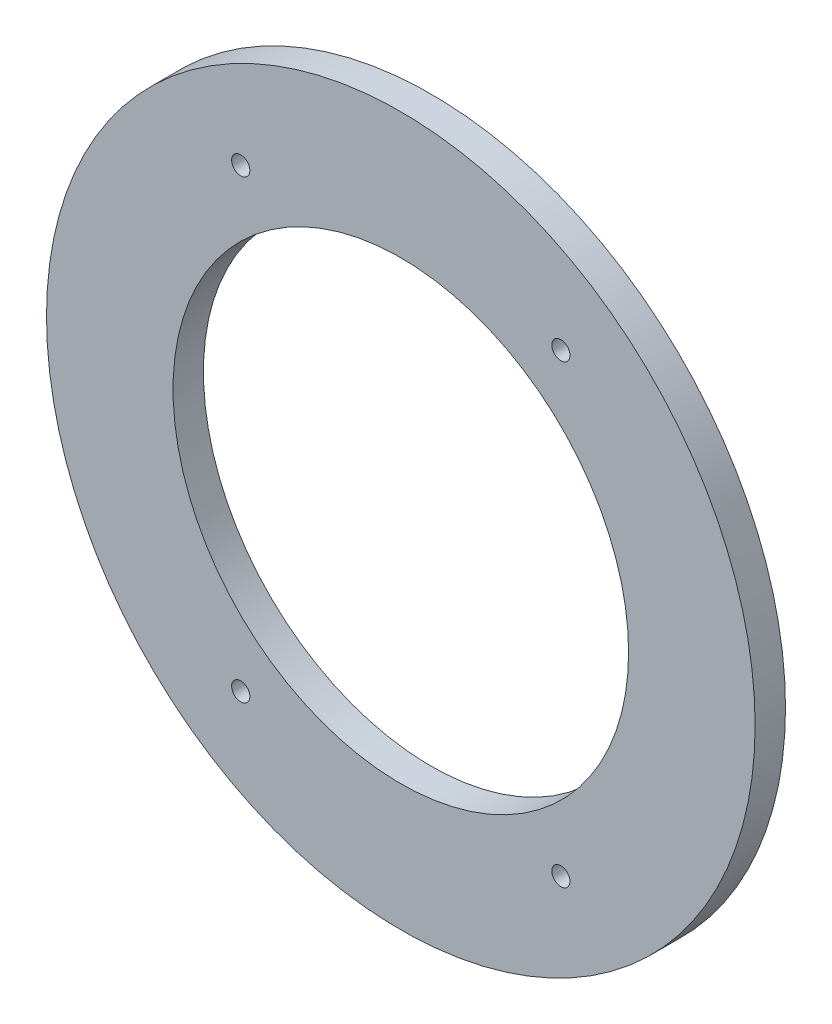
from build123d import *

# Parameters (mm, degrees)
ACRYLIC_BOARD_SKETCH_R    = 70
ACRYLIC_BOARD_SKETCH_R_2  = 45
ACRYLIC_BOARD_SKETCH_R_3  = 1.8
ACRYLIC_BOARD_DEPTH       = 6
WIRING_DITCH_1_DEPTH      = 0.5
DEVICE_DITCH_1_SKETCH_R   = 0.7
DEVICE_DITCH_1_SKETCH_R_2 = 1.8
DEVICE_DITCH_1_SKETCH_R_3 = 1.4
DEVICE_DITCH_1_DEPTH      = 3.5
DEVICE_DITCH_2_SKETCH_W   = 4
DEVICE_DITCH_2_SKETCH_H   = 1.483
DEVICE_DITCH_2_SKETCH_W_2 = 2.208
DEVICE_DITCH_2_SKETCH_H_2 = 1.204
DEVICE_DITCH_2_SKETCH_H_3 = 1.8
DEVICE_DITCH_2_SKETCH_H_4 = 2.966
DEVICE_DITCH_2_DEPTH      = 1.5
WIRING_DITCH_2_SKETCH_W   = 1.621419329
WIRING_DITCH_2_SKETCH_H   = 1.413
WIRING_DITCH_2_SKETCH_W_2 = 0.423202011
WIRING_DITCH_2_SKETCH_H_2 = 2.966
WIRING_DITCH_2_SKETCH_W_3 = 0.680017318
WIRING_DITCH_2_DEPTH      = 0.5


with BuildPart() as part:
    # acrylic board sketch → acrylic board (new body)
    with BuildSketch(Plane.XY):
        Circle(ACRYLIC_BOARD_SKETCH_R)
        Circle(ACRYLIC_BOARD_SKETCH_R_2, mode=Mode.SUBTRACT)
        with Locations((-31.623, 45)):
            Circle(ACRYLIC_BOARD_SKETCH_R_3, mode=Mode.SUBTRACT)
        with Locations((31.625, 45)):
            Circle(ACRYLIC_BOARD_SKETCH_R_3, mode=Mode.SUBTRACT)
        with Locations((31.623, -45)):
            Circle(ACRYLIC_BOARD_SKETCH_R_3, mode=Mode.SUBTRACT)
        with Locations((-31.623, -45)):
            Circle(ACRYLIC_BOARD_SKETCH_R_3, mode=Mode.SUBTRACT)
    extrude(amount=ACRYLIC_BOARD_DEPTH)

    # wiring ditch 1 sketch → wiring ditch 1 (cut)
    # profile 1 of 4: a face of its own
    with BuildSketch(Plane(origin=(0, 0, 0), x_dir=(-1, 0, 0), z_dir=(0, 0, -1))):
        Polygon((28.086824216, 58.298311689), (8.1117e-05, 64.716064274), (-28.073683973, 58.304614159), (-50.593630324, 40.351043203), (-63.058768743, 14.457487783), (-64.688870912, 0), (-63.058781159, -14.457377666), (-50.593630241, -40.361156881), (-28.073484596, -58.304659693), (0, -64.716045749), (28.073683973, -58.304614159), (50.593541654, -40.351113893), (63.094217318, -14.393964639), (63.094217318, 5.899242758), (63.094217318, 14.383851246), (50.593666945, 40.350967131), align=None)
        Polygon((0, 63.28), (-27.450658291, 57.010854209), (-49.470883109, 39.45567612), (-61.694217318, 14.064415221), (-63.28, 0), (-61.694217318, -14.064415221), (-49.470883109, -39.46567612), (-27.450658291, -57.010854209), (0, -63.28), (27.450658291, -57.010854209), (49.470883109, -39.45567612), (61.694217318, -14.074415221), (61.694217318, 5.899242758), (61.694217318, 14.064415221), (49.470883109, 39.45567612), (27.463651187, 57.004622403), align=None, mode=Mode.SUBTRACT)
    # profile 2 of 4: a face of its own
    with BuildSketch(Plane(origin=(0, 0, 0), x_dir=(-1, 0, 0), z_dir=(0, 0, -1))):
        Polygon((27.463651187, 57.004622403), (0, 63.28), (-27.450658291, 57.010854209), (-49.470883109, 39.45567612), (-61.694217318, 14.064415221), (-63.28, 0), (-61.694217318, -14.064415221), (-49.470883109, -39.46567612), (-27.450658291, -57.010854209), (0, -63.28), (27.450658291, -57.010854209), (49.470883109, -39.45567612), (61.694217318, -14.074415221), (61.694217318, 5.899242758), (61.694217318, 14.064415221), (49.470883109, 39.45567612), align=None)
        Polygon((-8.1117e-05, 61.843935726), (-26.827632609, 55.717094259), (-48.348135894, 38.560309037), (-60.329665893, 13.671342658), (-61.871129088, 0), (-60.329653477, -13.671452775), (-48.348135977, -38.570195359), (-26.827831986, -55.717048725), (0, -61.843954251), (26.827632609, -55.717094259), (48.348224564, -38.560238346), (60.294217318, -13.754865803), (60.294217318, 5.899242758), (60.294217318, 13.744979196), (48.348099273, 38.560385109), (26.840478159, 55.710933118), align=None, mode=Mode.SUBTRACT)
    # profile 3 of 4: a face of its own
    with BuildSketch(Plane(origin=(0, 0, 0), x_dir=(-1, 0, 0), z_dir=(0, 0, -1))):
        Polygon((-54.984505869, 12.623124619), (-44.022978515, 35.392345698), (-31.915926571, 40.144473297), (-24.709927404, 50.79185144), (-9.56e-07, 56.436057963), (24.79568596, 50.772296894), (30.95671437, 39.182859292), (43.988654142, 35.463644088), (55.019982682, 12.549432389), (55.019982682, 0), (55.019982682, -12.559562916), (43.98851079, -35.463685), (30.956715129, -39.182859075), (24.795696967, -50.772304086), (-1.196e-06, -56.436014954), (-24.790136434, -50.773531305), (-31.051894726, -39.183420211), (-43.989281808, -35.472596537), (-54.98452017, -12.622997879), (-56.408884631, 0), align=None)
        Polygon((-53.619982682, 12.229984779), (-42.999916891, 34.28992388), (-31, 39), (-23.859941709, 49.549945791), (0, 55), (23.859948813, 49.549977597), (30, 38), (42.999916891, 34.28992388), (53.619982682, 12.229984779), (53.619982682, 0), (53.619982682, -12.239984779), (42.999916891, -34.28992388), (30, -38), (23.859959836, -49.549983457), (0, -54.9999576), (-23.859941709, -49.549945791), (-30.1, -38), (-42.999916891, -34.29992388), (-53.619982682, -12.229984779), (-55, 0), align=None, mode=Mode.SUBTRACT)
    # profile 4 of 4: a face of its own
    with BuildSketch(Plane(origin=(0, 0, 0), x_dir=(-1, 0, 0), z_dir=(0, 0, -1))):
        Polygon((-42.999916891, 34.28992388), (-31, 39), (-23.859941709, 49.549945791), (0, 55), (23.859948813, 49.549977597), (30, 38), (42.999916891, 34.28992388), (53.619982682, 12.229984779), (53.619982682, 0), (53.619982682, -12.239984779), (42.999916891, -34.28992388), (30, -38), (23.859959836, -49.549983457), (0, -54.9999576), (-23.859941709, -49.549945791), (-30.1, -38), (-42.999916891, -34.29992388), (-53.619982682, -12.229984779), (-55, 0), (-53.619982682, 12.229984779), align=None)
        Polygon((-53.591115369, 0), (-52.255459495, 11.836844939), (-41.976855266, 33.187502062), (-30.084073429, 37.855526703), (-23.009956013, 48.308040142), (9.56e-07, 53.563942037), (22.924211666, 48.327658299), (29.04328563, 36.817140708), (42.01117964, 33.116203672), (52.219982682, 11.910537169), (52.219982682, 0), (52.219982682, -11.920406643), (42.011322992, -33.11616276), (29.043284871, -36.817140925), (22.924222705, -48.327662828), (1.196e-06, -53.563900245), (-22.929746983, -48.326360277), (-29.148105274, -36.816579789), (-42.010551973, -33.127251223), (-52.255445194, -11.836971679), align=None, mode=Mode.SUBTRACT)
    extrude(amount=-WIRING_DITCH_1_DEPTH, mode=Mode.SUBTRACT)

    # device ditch 1 sketch → device ditch 1 (cut)
    with BuildSketch(Plane(origin=(0, 0, 0), x_dir=(-1, 0, 0), z_dir=(0, 0, -1))):
        with Locations((57.6571, 13.1472)):
            Circle(DEVICE_DITCH_1_SKETCH_R)
        with Locations((46.2354, 36.8728)):
            Circle(DEVICE_DITCH_1_SKETCH_R)
        with Locations((25.6618, 53.2773)):
            Circle(DEVICE_DITCH_1_SKETCH_R)
        with Locations((0, 59.14)):
            Circle(DEVICE_DITCH_1_SKETCH_R)
        with Locations((-25.6553, 53.2804)):
            Circle(DEVICE_DITCH_1_SKETCH_R)
        with Locations((-46.2354, 36.8728)):
            Circle(DEVICE_DITCH_1_SKETCH_R)
        with Locations((-57.6571, 13.1472)):
            Circle(DEVICE_DITCH_1_SKETCH_R)
        with Locations((-59.14, 0)):
            Circle(DEVICE_DITCH_1_SKETCH_R)
        with Locations((-57.6571, -13.1472)):
            Circle(DEVICE_DITCH_1_SKETCH_R)
        with Locations((-46.2354, -36.8828)):
            Circle(DEVICE_DITCH_1_SKETCH_R)
        with Locations((-25.6553, -53.2804)):
            Circle(DEVICE_DITCH_1_SKETCH_R)
        with Locations((0, -59.14)):
            Circle(DEVICE_DITCH_1_SKETCH_R)
        with Locations((25.6553, -53.2804)):
            Circle(DEVICE_DITCH_1_SKETCH_R)
        with Locations((46.2354, -36.8728)):
            Circle(DEVICE_DITCH_1_SKETCH_R)
        with Locations((57.6571, -13.1572)):
            Circle(DEVICE_DITCH_1_SKETCH_R)
        with Locations((0, 50.56)):
            Circle(DEVICE_DITCH_1_SKETCH_R_2)
        with Locations((21.93716185, 45.552985961)):
            Circle(DEVICE_DITCH_1_SKETCH_R_2)
        with Locations((39.529399754, 31.523644382)):
            Circle(DEVICE_DITCH_1_SKETCH_R_2)
        with Locations((49.29235524, 11.250658421)):
            Circle(DEVICE_DITCH_1_SKETCH_R_2)
        with Locations((49.29235524, -11.250658421)):
            Circle(DEVICE_DITCH_1_SKETCH_R_2)
        with Locations((39.529399754, -31.523644382)):
            Circle(DEVICE_DITCH_1_SKETCH_R_2)
        with Locations((21.93716185, -45.552985961)):
            Circle(DEVICE_DITCH_1_SKETCH_R_2)
        with Locations((0, -50.56)):
            Circle(DEVICE_DITCH_1_SKETCH_R_2)
        with Locations((-21.93716185, -45.552985961)):
            Circle(DEVICE_DITCH_1_SKETCH_R_2)
        with Locations((-39.529399754, -31.523644382)):
            Circle(DEVICE_DITCH_1_SKETCH_R_2)
        with Locations((-49.29235524, -11.250658421)):
            Circle(DEVICE_DITCH_1_SKETCH_R_2)
        with Locations((-49.29235524, 11.250658421)):
            Circle(DEVICE_DITCH_1_SKETCH_R_2)
        with Locations((-39.529399754, 31.523644382)):
            Circle(DEVICE_DITCH_1_SKETCH_R_2)
        with Locations((-21.93716185, 45.552985961)):
            Circle(DEVICE_DITCH_1_SKETCH_R_2)
        with Locations((-50.56, 0)):
            Circle(DEVICE_DITCH_1_SKETCH_R_2)
        with Locations((0, 63.28)):
            Circle(DEVICE_DITCH_1_SKETCH_R_3)
        with Locations((0, 55)):
            Circle(DEVICE_DITCH_1_SKETCH_R_3)
        with Locations((23.863605651, 49.553287735)):
            Circle(DEVICE_DITCH_1_SKETCH_R_3)
        with Locations((27.456163011, 57.013309961)):
            Circle(DEVICE_DITCH_1_SKETCH_R_3)
        with Locations((43.000731536, 34.291939102)):
            Circle(DEVICE_DITCH_1_SKETCH_R_3)
        with Locations((49.474296211, 39.454434662)):
            Circle(DEVICE_DITCH_1_SKETCH_R_3)
        with Locations((53.62103517, 12.238651368)):
            Circle(DEVICE_DITCH_1_SKETCH_R_3)
        with Locations((61.693438283, 14.081124701)):
            Circle(DEVICE_DITCH_1_SKETCH_R_3)
        with Locations((53.62103517, -12.238651368)):
            Circle(DEVICE_DITCH_1_SKETCH_R_3)
        with Locations((61.693438283, -14.081124701)):
            Circle(DEVICE_DITCH_1_SKETCH_R_3)
        with Locations((43.000731536, -34.291939102)):
            Circle(DEVICE_DITCH_1_SKETCH_R_3)
        with Locations((49.474296211, -39.454434662)):
            Circle(DEVICE_DITCH_1_SKETCH_R_3)
        with Locations((23.863605651, -49.553287735)):
            Circle(DEVICE_DITCH_1_SKETCH_R_3)
        with Locations((27.456163011, -57.013309961)):
            Circle(DEVICE_DITCH_1_SKETCH_R_3)
        with Locations((0, -55)):
            Circle(DEVICE_DITCH_1_SKETCH_R_3)
        with Locations((0, -63.28)):
            Circle(DEVICE_DITCH_1_SKETCH_R_3)
        with Locations((-23.863605651, -49.553287735)):
            Circle(DEVICE_DITCH_1_SKETCH_R_3)
        with Locations((-27.456163011, -57.013309961)):
            Circle(DEVICE_DITCH_1_SKETCH_R_3)
        with Locations((-43.000731536, -34.291939102)):
            Circle(DEVICE_DITCH_1_SKETCH_R_3)
        with Locations((-49.474296211, -39.454434662)):
            Circle(DEVICE_DITCH_1_SKETCH_R_3)
        with Locations((-53.62103517, -12.238651368)):
            Circle(DEVICE_DITCH_1_SKETCH_R_3)
        with Locations((-61.693438283, -14.081124701)):
            Circle(DEVICE_DITCH_1_SKETCH_R_3)
        with Locations((-53.62103517, 12.238651368)):
            Circle(DEVICE_DITCH_1_SKETCH_R_3)
        with Locations((-61.693438283, 14.081124701)):
            Circle(DEVICE_DITCH_1_SKETCH_R_3)
        with Locations((-43.000731536, 34.291939102)):
            Circle(DEVICE_DITCH_1_SKETCH_R_3)
        with Locations((-49.474296211, 39.454434662)):
            Circle(DEVICE_DITCH_1_SKETCH_R_3)
        with Locations((-23.863605651, 49.553287735)):
            Circle(DEVICE_DITCH_1_SKETCH_R_3)
        with Locations((-27.456163011, 57.013309961)):
            Circle(DEVICE_DITCH_1_SKETCH_R_3)
        with Locations((-63.28, 0)):
            Circle(DEVICE_DITCH_1_SKETCH_R_3)
        with Locations((-55, 0)):
            Circle(DEVICE_DITCH_1_SKETCH_R_3)
    extrude(amount=-DEVICE_DITCH_1_DEPTH, mode=Mode.SUBTRACT)

    # device ditch 2 sketch → device ditch 2 (cut)
    with BuildSketch(Plane(origin=(0, 0, 0), x_dir=(-1, 0, 0), z_dir=(0, 0, -1))):
        with Locations((57.7, 0.7415)):
            Rectangle(DEVICE_DITCH_2_SKETCH_W, DEVICE_DITCH_2_SKETCH_H)
        with Locations((57.7, -0.7415)):
            Rectangle(DEVICE_DITCH_2_SKETCH_W, DEVICE_DITCH_2_SKETCH_H)
        with Locations((67, 0.602)):
            Rectangle(DEVICE_DITCH_2_SKETCH_W_2, DEVICE_DITCH_2_SKETCH_H_2)
        with Locations((67, -0.602)):
            Rectangle(DEVICE_DITCH_2_SKETCH_W_2, DEVICE_DITCH_2_SKETCH_H_2)
        with Locations((67, -2.104)):
            Rectangle(DEVICE_DITCH_2_SKETCH_W_2, DEVICE_DITCH_2_SKETCH_H_3)
        with Locations((65.517419329, -5.9)):
            Rectangle(DEVICE_DITCH_2_SKETCH_W, DEVICE_DITCH_2_SKETCH_H_4)
    extrude(amount=-DEVICE_DITCH_2_DEPTH, mode=Mode.SUBTRACT)

    # wiring ditch 2 sketch → wiring ditch 2 (cut)
    with BuildSketch(Plane(origin=(0, 0, 0), x_dir=(-1, 0, 0), z_dir=(0, 0, -1))):
        with Locations((66.706709665, -3.7105)):
            Rectangle(WIRING_DITCH_2_SKETCH_W, WIRING_DITCH_2_SKETCH_H)
        with Locations((63.305818324, -5.9)):
            Rectangle(WIRING_DITCH_2_SKETCH_W_2, WIRING_DITCH_2_SKETCH_H_2)
        with Locations((55.359991341, 0)):
            Rectangle(WIRING_DITCH_2_SKETCH_W_3, WIRING_DITCH_2_SKETCH_H_2)
    extrude(amount=-WIRING_DITCH_2_DEPTH, mode=Mode.SUBTRACT)


solid = part.part
